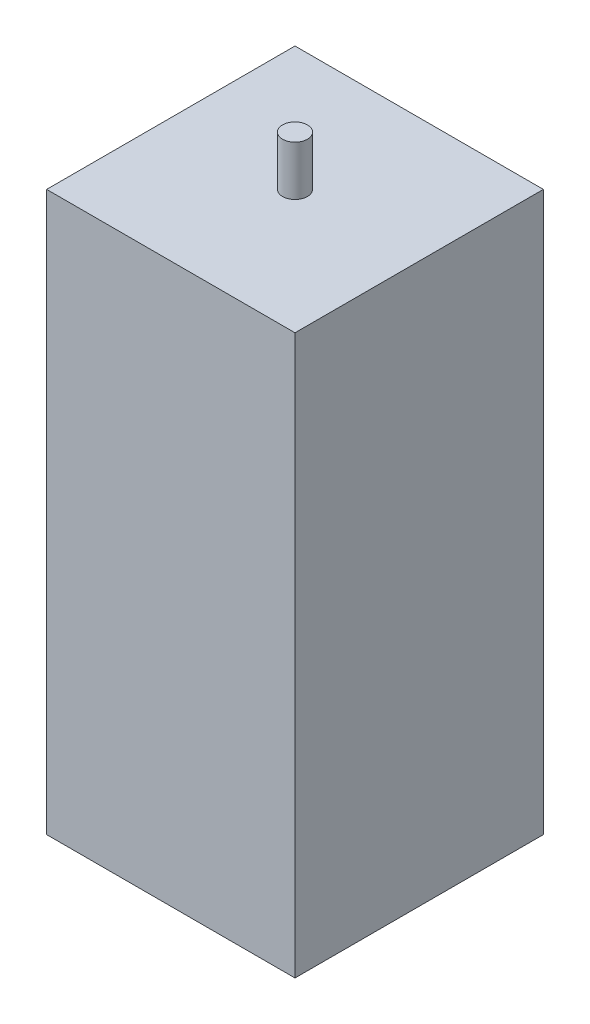
from build123d import *

# Parameters (mm, degrees)
SKETCH_1_W           = 10
SKETCH_1_H           = 22.5
EXTRUDE_1_DEPTH      = 10
EXTRUDE_2_DEPTH      = 2
EXTRUDE_2_DEPTH_BACK = 24.5
SKETCH_2_R           = 0.5


with BuildPart() as part:
    # 草图1 → 凸台-拉伸1 (new body)
    with BuildSketch(Plane.XY):
        Rectangle(SKETCH_1_W, SKETCH_1_H)
    extrude(amount=EXTRUDE_1_DEPTH)

    # 草图2 → 凸台-拉伸2 (add, two sides: drawn at the far end of the back side and taken through both)
    with BuildSketch(Plane(origin=(0, 11.25, 0), x_dir=(1, 0, 0), z_dir=(0, 1, 0)).offset(-EXTRUDE_2_DEPTH_BACK)):
        with Locations(Location((0, -5, 0), (0, 0, 270))):
            Circle(SKETCH_2_R)
    extrude(amount=EXTRUDE_2_DEPTH + EXTRUDE_2_DEPTH_BACK)


solid = part.part
